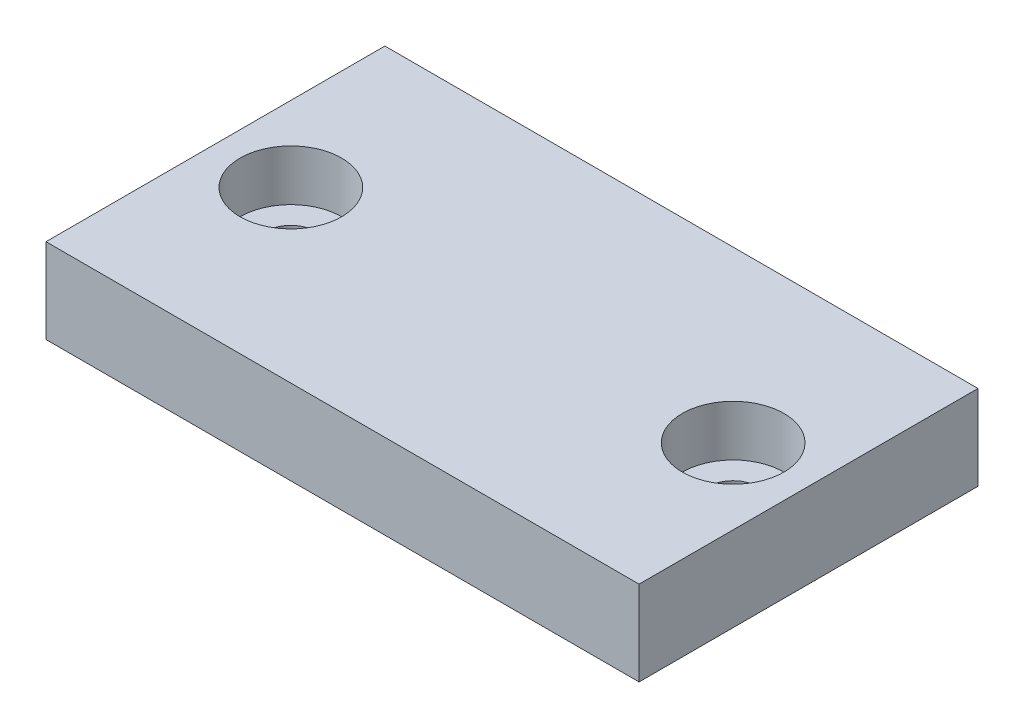
from build123d import *

# Parameters (mm, degrees)
SKETCH2_W           = 35
SKETCH2_H           = 20
SKETCH2_R           = 1.5
BOSS_EXTRUDE1_DEPTH = 5
SKETCH3_R           = 3
CUT_EXTRUDE1_DEPTH  = 3


with BuildPart() as part:
    # Sketch2 → Boss-Extrude1 (new body)
    with BuildSketch(Plane(origin=(0, 0, 0), x_dir=(1, 0, 0), z_dir=(0, 1, 0))):
        Rectangle(SKETCH2_W, SKETCH2_H)
        with Locations(Location((-13.05, 0, 0), (0, 0, 270))):
            Circle(SKETCH2_R, mode=Mode.SUBTRACT)
        with Locations(Location((13.05, 0, 0), (0, 0, 270))):
            Circle(SKETCH2_R, mode=Mode.SUBTRACT)
    extrude(amount=BOSS_EXTRUDE1_DEPTH)

    # Sketch3 → Cut-Extrude1 (cut)
    with BuildSketch(Plane(origin=(0, 5, 0), x_dir=(1, 0, 0), z_dir=(0, 1, 0))):
        with Locations(Location((-13.05, 0, 0), (0, 0, 270))):
            Circle(SKETCH3_R)
        with Locations(Location((13.05, 0, 0), (0, 0, 270))):
            Circle(SKETCH3_R)
    extrude(amount=-CUT_EXTRUDE1_DEPTH, mode=Mode.SUBTRACT)


solid = part.part
